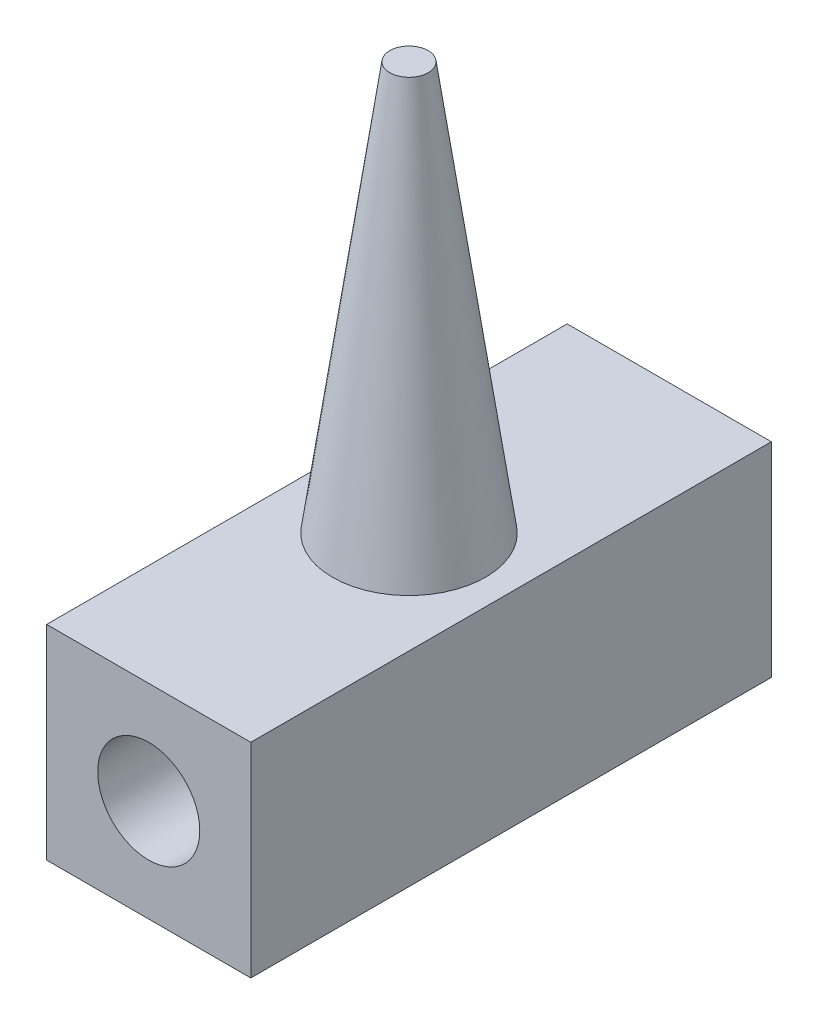
from build123d import *

# Parameters (mm, degrees)
SKETCH2_W           = 20
SKETCH2_H           = 20
BOSS_EXTRUDE1_DEPTH = 51
SKETCH3_R           = 5
CUT_EXTRUDE1_DEPTH  = 51
SKETCH4_R           = 7.5
BOSS_EXTRUDE2_DEPTH = 40
BOSS_EXTRUDE2_TAPER = 8


with BuildPart() as part:
    # Sketch2 → Boss-Extrude1 (new body)
    with BuildSketch(Plane.XY):
        with Locations((-14.75, 2.75)):
            Rectangle(SKETCH2_W, SKETCH2_H)
    extrude(amount=BOSS_EXTRUDE1_DEPTH)

    # Sketch3 → Cut-Extrude1 (cut)
    with BuildSketch(Plane.XY.offset(51)):
        with Locations((-14.75, 2.75)):
            Circle(SKETCH3_R)
    extrude(amount=-CUT_EXTRUDE1_DEPTH, mode=Mode.SUBTRACT)

    # Sketch4 → Boss-Extrude2 (add)
    with BuildSketch(Plane(origin=(0, 12.75, 0), x_dir=(1, 0, 0), z_dir=(0, 1, 0))):
        with Locations((-14.75, -25.5)):
            Circle(SKETCH4_R)
    extrude(amount=BOSS_EXTRUDE2_DEPTH, taper=BOSS_EXTRUDE2_TAPER)


solid = part.part
